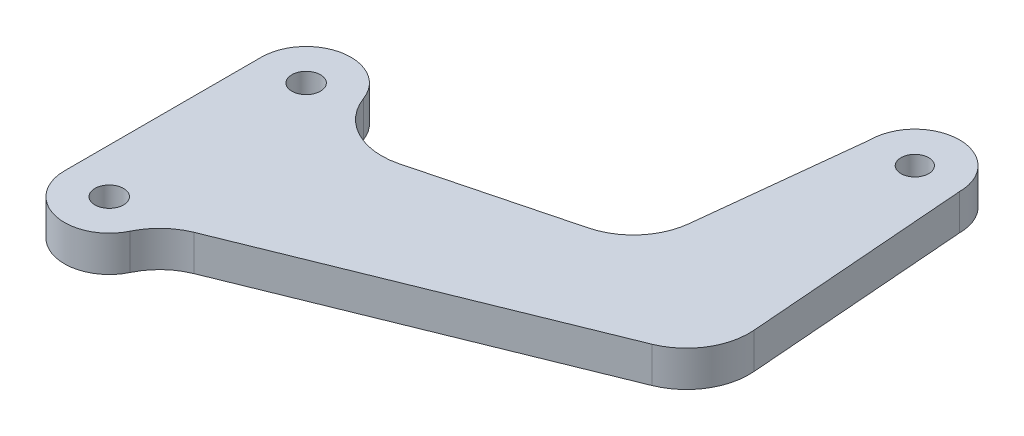
from build123d import *

# Parameters (mm, degrees)
BOSS_EXTRUDE1_DEPTH      = 2
BOSS_EXTRUDE1_DEPTH_BACK = 2
SKETCH1_R                = 1.6
BOSS_EXTRUDE3_DEPTH      = 2
BOSS_EXTRUDE3_DEPTH_BACK = 2
SKETCH3_R                = 1.55
FILLET1_R                = 7


with BuildPart() as part:
    # Sketch1 → Boss-Extrude1 (new, two sides: drawn at the far end of the back side and taken through both)
    with BuildSketch(Plane(origin=(0, 0, 0), x_dir=(1, 0, 0), z_dir=(0, 1, 0)).offset(-BOSS_EXTRUDE1_DEPTH_BACK)):
        with BuildLine():
            Line((5, -11), (5, 11))
            ThreePointArc((5, 11), (0, 16), (-5, 11))
            Line((-5, 11), (-5, -11))
            ThreePointArc((-5, -11), (0, -16), (5, -11))
        make_face()
        with Locations((0, 11)):
            Circle(SKETCH1_R, mode=Mode.SUBTRACT)
        with Locations((0, -11)):
            Circle(SKETCH1_R, mode=Mode.SUBTRACT)
    extrude(amount=BOSS_EXTRUDE1_DEPTH + BOSS_EXTRUDE1_DEPTH_BACK)

    # Sketch3 → Boss-Extrude3 (add, two sides: drawn at the far end of the back side and taken through both)
    with BuildSketch(Plane(origin=(0, 0, 0), x_dir=(1, 0, 0), z_dir=(0, 1, 0)).offset(-BOSS_EXTRUDE3_DEPTH_BACK)):
        with BuildLine():
            Line((34.468399727, 13.95420099), (5, 6.305712988))
            Line((5, 6.305712988), (5, -11))
            Line((5, -11), (49.334489528, 6.966618691))
            Line((49.334489528, 6.966618691), (47, 37))
            ThreePointArc((47, 37), (42, 42), (37, 37))
            Line((37, 37), (34.468399727, 13.95420099))
        make_face()
        with Locations((42, 37)):
            Circle(SKETCH3_R, mode=Mode.SUBTRACT)
    extrude(amount=BOSS_EXTRUDE3_DEPTH + BOSS_EXTRUDE3_DEPTH_BACK)

    # Fillet1
    fillet1_edges = [part.edges().sort_by_distance(p)[0] for p in [
        (5, 0, 11),
        (49.334489528, 0, -6.966618691),
        (34.468399727, 0, -13.95420099),
        (5, 0, -6.305712988),
    ]]
    fillet(fillet1_edges, radius=FILLET1_R)


solid = part.part
